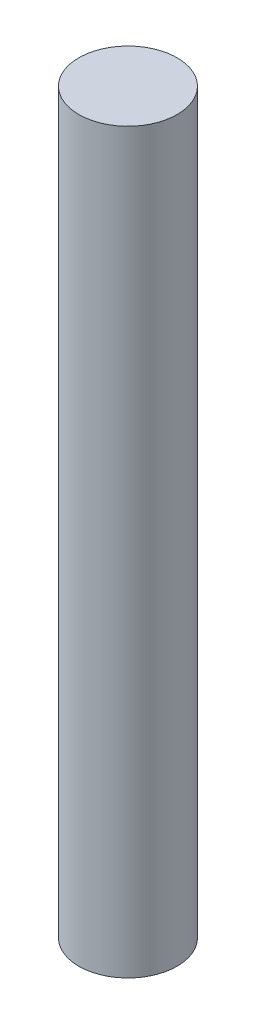
from build123d import *

# Parameters (mm, degrees)
SKETCH_1_R      = 0.6
EXTRUDE_1_DEPTH = 9


with BuildPart() as part:
    # 草图1 → 凸台-拉伸1 (new body)
    with BuildSketch(Plane(origin=(0, 0, 0), x_dir=(1, 0, 0), z_dir=(0, 1, 0))):
        with Locations(Location((0, 0, 0), (0, 0, 270))):
            Circle(SKETCH_1_R)
    extrude(amount=EXTRUDE_1_DEPTH)


solid = part.part
